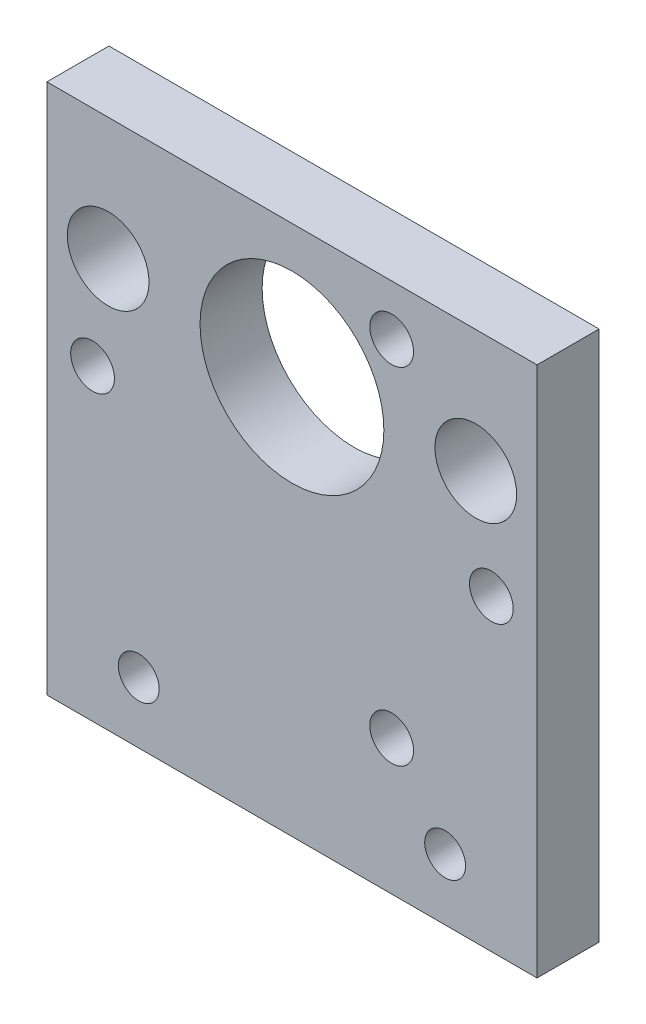
from build123d import *

# Parameters (mm, degrees)
SKETCH1_W                           = 38.1
SKETCH1_H                           = 41.275
BOSS_EXTRUDE1_DEPTH                 = 4.826
SKETCH2_R                           = 7.14375
CUT_EXTRUDE1_DEPTH                  = 29.497353952
F_3_4_3_4_DIAMETER_HOLE1_D          = 3.4
F_1_4_0_25_DIAMETER_HOLE1_D         = 6.35
F_1_8_0_125_CLEARANCE_DOWEL_HOLE1_D = 3.175


with BuildPart() as part:
    # Sketch1 → Boss-Extrude1 (new body)
    with BuildSketch(Plane.XY):
        Rectangle(SKETCH1_W, SKETCH1_H)
    extrude(amount=BOSS_EXTRUDE1_DEPTH)

    # Sketch2 → Cut-Extrude1 (cut, through all)
    with BuildSketch(Plane.XY.offset(4.826)):
        with Locations((0, 10.287)):
            Circle(SKETCH2_R)
    extrude(amount=-CUT_EXTRUDE1_DEPTH, mode=Mode.SUBTRACT)

    # Ø3.4 (3.4) Diameter Hole1 (through all)
    with Locations(Plane.XY.offset(4.826)):
        with Locations((-15.5, 3.287), (7.75, 16.710393759), (15.5, 3.287), (7.75, -10.136393759)):
            Hole(F_3_4_3_4_DIAMETER_HOLE1_D / 2)

    # 1/4 (0.25) Diameter Hole1 (through all)
    with Locations(Plane.XY.offset(4.826)):
        with Locations((-14.2875, 11.1125), (14.2875, 11.1125)):
            Hole(F_1_4_0_25_DIAMETER_HOLE1_D / 2)

    # 1/8 (0.125) Clearance Dowel Hole1 (through all)
    with Locations(Plane.XY.offset(4.826)):
        with Locations((-11.90625, -15.875), (11.90625, -15.875)):
            Hole(F_1_8_0_125_CLEARANCE_DOWEL_HOLE1_D / 2)


solid = part.part
